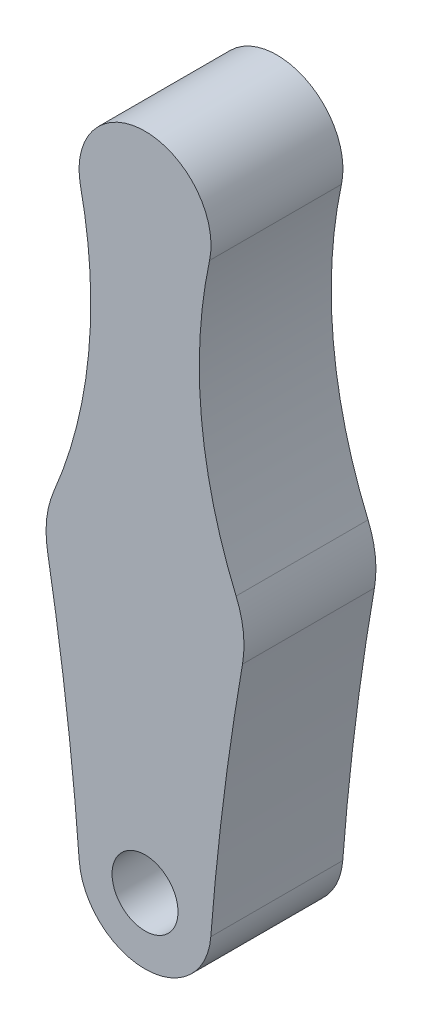
from build123d import *

# Parameters (mm, degrees)
SKETCH1_R           = 5
SKETCH1_R_2         = 7.5
BOSS_EXTRUDE1_DEPTH = 5
SKETCH2_R           = 2.5
CUT_EXTRUDE1_DEPTH  = 10


with BuildPart() as part:
    # Sketch1 → Boss-Extrude1 (new, symmetric)
    with BuildSketch(Plane.XY):
        with BuildLine():
            ThreePointArc((-4.889177102, 43.953125), (-4.272856259, 33.288034301), (-6.902367673, 22.933823529))
            ThreePointArc((-6.902367673, 22.933823529), (0, 27.5), (6.902367673, 22.933823529))
            ThreePointArc((6.902367673, 22.933823529), (4.272856259, 33.288034301), (4.889177102, 43.953125))
            ThreePointArc((4.889177102, 43.953125), (0, 40), (-4.889177102, 43.953125))
        make_face()
        with Locations((0, 45)):
            Circle(SKETCH1_R)
        with Locations((0, 20)):
            Circle(SKETCH1_R_2)
        with BuildLine():
            ThreePointArc((-4.985162527, -0.384908537), (-0.192597204, 4.996289255), (5, 0))
            ThreePointArc((5, 0), (4.996289255, -0.192597204), (4.985162527, -0.384908537))
            ThreePointArc((4.985162527, -0.384908537), (5.956670882, 9.189806563), (7.387650492, 18.706701807))
            ThreePointArc((7.387650492, 18.706701807), (0, 12.5), (-7.387650492, 18.706701807))
            ThreePointArc((-7.387650492, 18.706701807), (-5.956670882, 9.189806563), (-4.985162527, -0.384908537))
        make_face()
        Circle(SKETCH1_R)
    extrude(amount=BOSS_EXTRUDE1_DEPTH, both=True)

    # Sketch2 → Cut-Extrude1 (cut)
    with BuildSketch(Plane(origin=(0, 0, -5), x_dir=(-1, 0, 0), z_dir=(0, 0, -1))):
        Circle(SKETCH2_R)
    extrude(amount=-CUT_EXTRUDE1_DEPTH, mode=Mode.SUBTRACT)


solid = part.part
